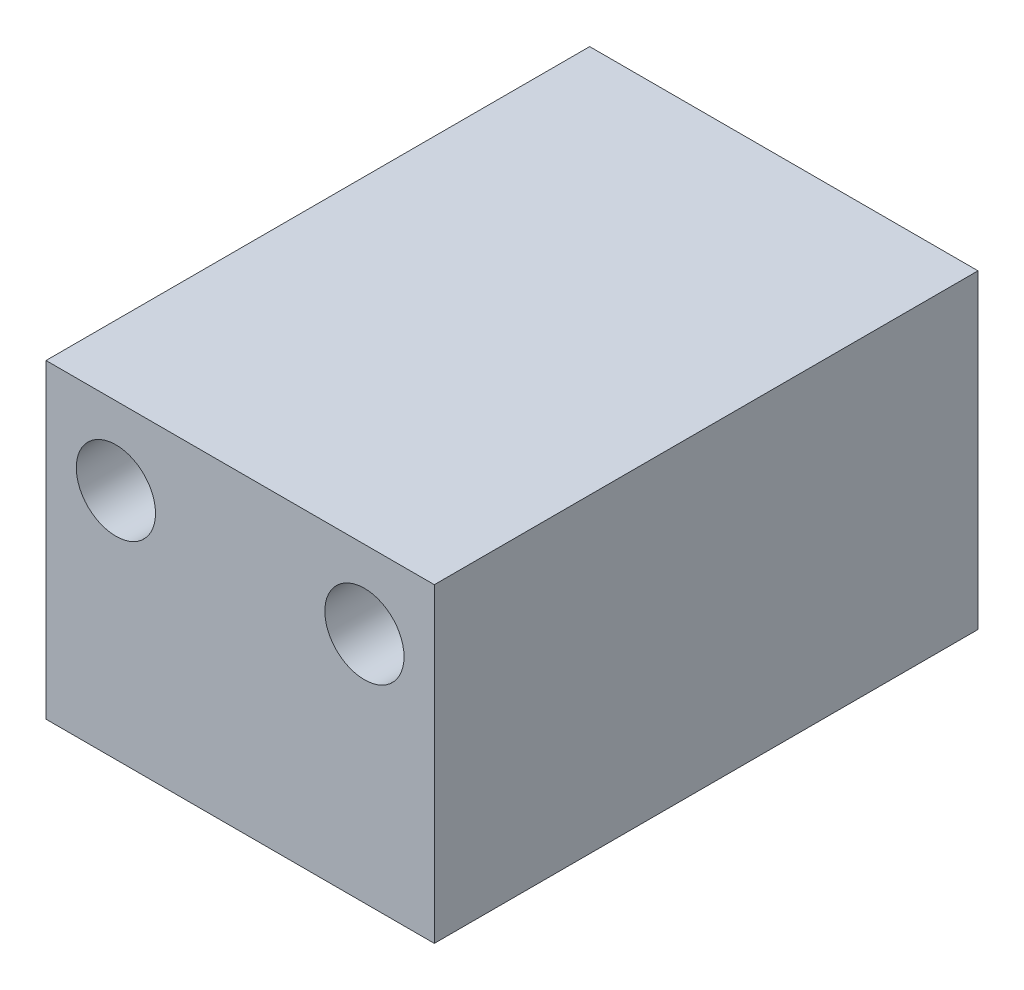
from build123d import *

# Parameters (mm, degrees)
SKETCH1_W           = 25
SKETCH1_H           = 35
BOSS_EXTRUDE1_DEPTH = 20
SKETCH3_R           = 2.55
CUT_EXTRUDE2_DEPTH  = 48.434164903
SKETCH4_R           = 2.25
CUT_EXTRUDE3_DEPTH  = 10


with BuildPart() as part:
    # Sketch1 → Boss-Extrude1 (new body)
    with BuildSketch(Plane(origin=(0, 0, 0), x_dir=(1, 0, 0), z_dir=(0, 1, 0))):
        with Locations((12.5, 17.5)):
            Rectangle(SKETCH1_W, SKETCH1_H)
    extrude(amount=BOSS_EXTRUDE1_DEPTH)

    # Sketch3 → Cut-Extrude2 (cut, through all)
    with BuildSketch(Plane.XY):
        with Locations((4.5, 15)):
            Circle(SKETCH3_R)
        with Locations((20.5, 15)):
            Circle(SKETCH3_R)
    extrude(amount=-CUT_EXTRUDE2_DEPTH, mode=Mode.SUBTRACT)

    # Sketch4 → Cut-Extrude3 (cut)
    with BuildSketch(Plane.XZ):
        with Locations(Location((12.5, -5, 0), (0, 0, 270))):
            Circle(SKETCH4_R)
        with Locations(Location((12.5, -30, 0), (0, 0, 270))):
            Circle(SKETCH4_R)
    extrude(amount=-CUT_EXTRUDE3_DEPTH, mode=Mode.SUBTRACT)


solid = part.part
